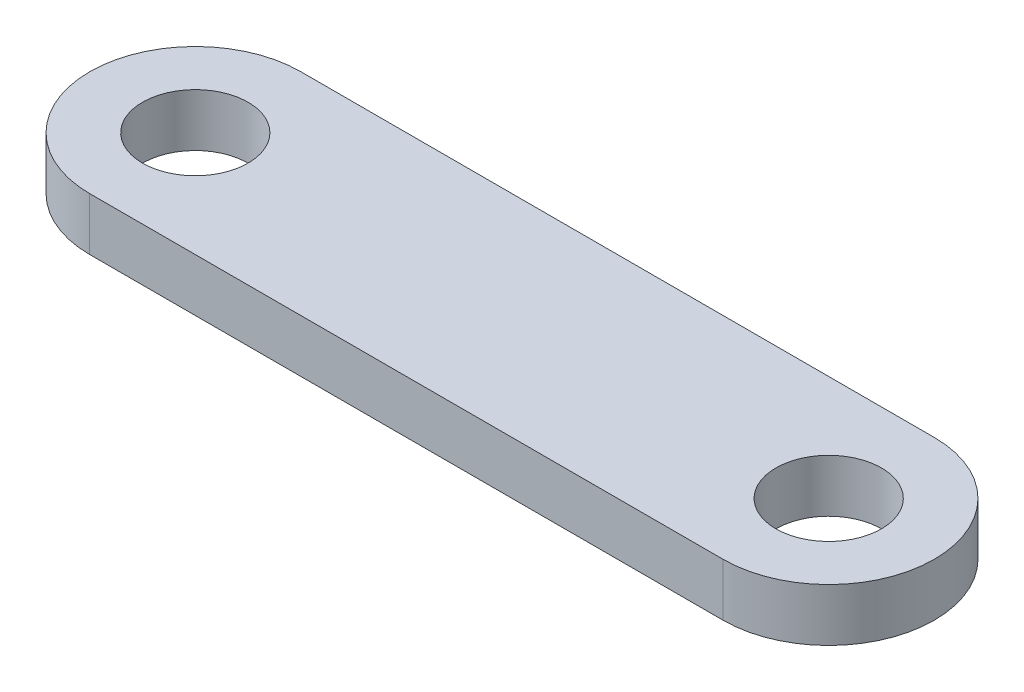
from build123d import *

# Parameters (mm, degrees)
SKETCH1_R           = 5
BOSS_EXTRUDE1_DEPTH = 5


with BuildPart() as part:
    # Sketch1 → Boss-Extrude1 (new body)
    with BuildSketch(Plane(origin=(0, 0, 0), x_dir=(1, 0, 0), z_dir=(0, 1, 0))):
        with BuildLine():
            Line((-72.346809709, 10), (-12.346809709, 10))
            ThreePointArc((-12.346809709, 10), (-2.346809709, 0), (-12.346809709, -10))
            Line((-12.346809709, -10), (-72.346809709, -10))
            ThreePointArc((-72.346809709, -10), (-82.346809709, 0), (-72.346809709, 10))
        make_face()
        with Locations(Location((-72.346809709, 0, 0), (0, 0, 270))):
            Circle(SKETCH1_R, mode=Mode.SUBTRACT)
        with Locations(Location((-12.346809709, 0, 0), (0, 0, 270))):
            Circle(SKETCH1_R, mode=Mode.SUBTRACT)
    extrude(amount=BOSS_EXTRUDE1_DEPTH)


solid = part.part
